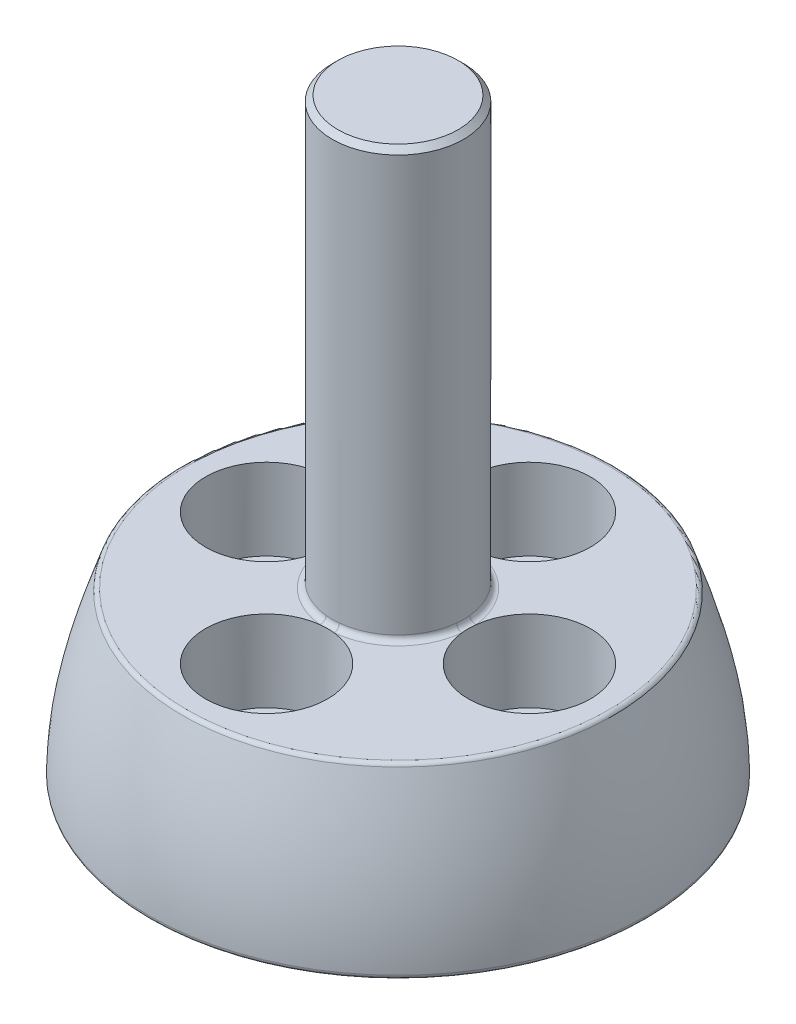
from build123d import *

# Parameters (mm, degrees)
CBORE_FOR_M3_SHCS1_D           = 3.2
CBORE_FOR_M3_SHCS1_CBORE_D     = 5.57
CBORE_FOR_M3_SHCS1_CBORE_DEPTH = 3.71
SKETCH6_R                      = 2
CUT_EXTRUDE1_DEPTH             = 6.85
FILLET1_R                      = 0.254
CHAMFER1_SIZE                  = 0.254
FILLET2_R                      = 0.2032


with BuildPart() as part:
    # Sketch2 → Revolve1 (revolve)
    with BuildSketch(Plane.XY, mode=Mode.PRIVATE) as revolve1_sk:
        with BuildLine():
            Line((0, 0), (11.3538, 0))
            add(Edge.make_bspline(
                [(11.3538, 0), (11.3538, 2.621582021), (10.633364827, 5.02311439), (9.779, 7.493)],
                knots=[0, 0, 0, 0, 1, 1, 1, 1], degree=3))
            Line((9.779, 7.493), (2.9972, 7.493))
            Line((2.9972, 7.493), (2.9972, 26.9748))
            Line((2.9972, 26.9748), (0, 26.9748))
            Line((0, 26.9748), (0, 0))
        make_face()
    revolve(revolve1_sk.sketch.rotate(Axis((0, 0, 0), (0, 1, 0)), 90), axis=Axis((0, 0, 0), (0, 1, 0)))

    # CBORE for M3 SHCS1 (through all)
    with Locations(Plane(origin=(0, 7.493, 0), x_dir=(1, 0, 0), z_dir=(0, 1, 0))):
        with Locations((0, 6), (6, 0), (0, -6), (-6, 0)):
            CounterBoreHole(CBORE_FOR_M3_SHCS1_D / 2, CBORE_FOR_M3_SHCS1_CBORE_D / 2, CBORE_FOR_M3_SHCS1_CBORE_DEPTH)

    # Sketch6 → Cut-Extrude1 (cut)
    with BuildSketch(Plane.XZ):
        with Locations(Location((0, 0, 0), (0, 0, 270))):
            Circle(SKETCH6_R)
    extrude(amount=-CUT_EXTRUDE1_DEPTH, mode=Mode.SUBTRACT)

    # Fillet1
    fillet1_edges = [part.edges().sort_by_distance(p)[0] for p in [
        (0, 7.493, 2.9972),
    ]]
    fillet(fillet1_edges, radius=FILLET1_R)

    # Chamfer1
    chamfer1_edges = [part.edges().sort_by_distance(p)[0] for p in [
        (0, 26.9748, 2.9972),
    ]]
    chamfer(chamfer1_edges, length=CHAMFER1_SIZE)

    # Fillet2
    fillet2_edges = [part.edges().sort_by_distance(p)[0] for p in [
        (0, 0, 11.3538),
        (0, 7.493, 9.779),
    ]]
    fillet(fillet2_edges, radius=FILLET2_R)


solid = part.part
